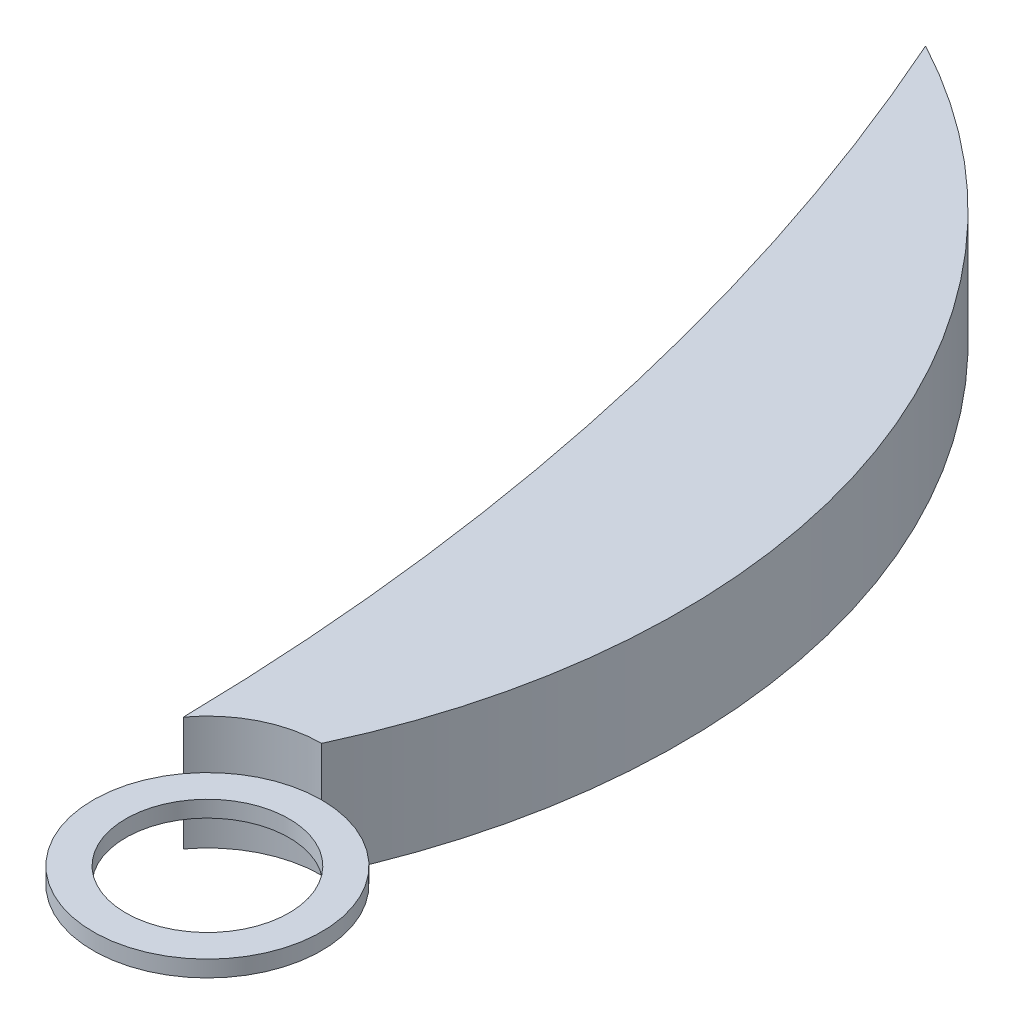
from build123d import *

# Parameters (mm, degrees)
BOSS_EXTRUDE1_DEPTH = 355.6
CUT_EXTRUDE2_START  = -152.4
SKETCH5_R           = 355.6
CUT_EXTRUDE2_DEPTH  = 152.4
SKETCH6_R           = 355.6
CUT_EXTRUDE3_DEPTH  = 152.4
SKETCH7_R           = 254
CUT_EXTRUDE4_DEPTH  = 152.4
CUT_EXTRUDE5_DEPTH  = 635
SCALE1_SCALE        = 0.214285714


with BuildPart() as part:
    # Sketch2 → Boss-Extrude1 (new body)
    with BuildSketch(Plane(origin=(0, 0, 0), x_dir=(1, 0, 0), z_dir=(0, 1, 0))):
        with BuildLine():
            ThreePointArc((-939.8, 3175), (-1137.137455821, 1577.520446779), (-285.969579472, 211.359314005))
            ThreePointArc((-285.969579472, 211.359314005), (160.143666656, -317.498607918), (0, 355.6))
            ThreePointArc((0, 355.6), (92.407240491, 1952.73574683), (-939.8, 3175))
        make_face()
    extrude(amount=BOSS_EXTRUDE1_DEPTH)

    # Sketch5 → Cut-Extrude2 (cut)
    with BuildSketch(Plane(origin=(0, 355.6, 0), x_dir=(1, 0, 0), z_dir=(0, 1, 0)).offset(CUT_EXTRUDE2_START)):
        Circle(SKETCH5_R)
    extrude(amount=CUT_EXTRUDE2_DEPTH, mode=Mode.SUBTRACT)

    # Sketch6 → Cut-Extrude3 (cut)
    with BuildSketch(Plane.XZ):
        Circle(SKETCH6_R)
    extrude(amount=-CUT_EXTRUDE3_DEPTH, mode=Mode.SUBTRACT)

    # Sketch7 → Cut-Extrude4 (cut)
    with BuildSketch(Plane(origin=(0, 203.2, 0), x_dir=(1, 0, 0), z_dir=(0, 1, 0))):
        Circle(SKETCH7_R)
    extrude(amount=-CUT_EXTRUDE4_DEPTH, mode=Mode.SUBTRACT)

    # Sketch8 → Cut-Extrude5 (cut)
    with BuildSketch(Plane.XZ):
        with BuildLine():
            ThreePointArc((-285.969579472, -211.359314005), (-1137.137455821, -1577.520446779), (-939.8, -3175))
            ThreePointArc((-939.8, -3175), (-463.84673696, -1726.060030518), (-285.969579472, -211.359314005))
        make_face()
    extrude(amount=-CUT_EXTRUDE5_DEPTH, mode=Mode.SUBTRACT)


with BuildPart() as part_1:
    # Scale1: scaled about (-224.977664094, 177.8, -1642.651878674)
    add(part.part.scale(SCALE1_SCALE).moved(Location((-176.768164645, 139.7, -1290.65504753))))


solid = part_1.part
